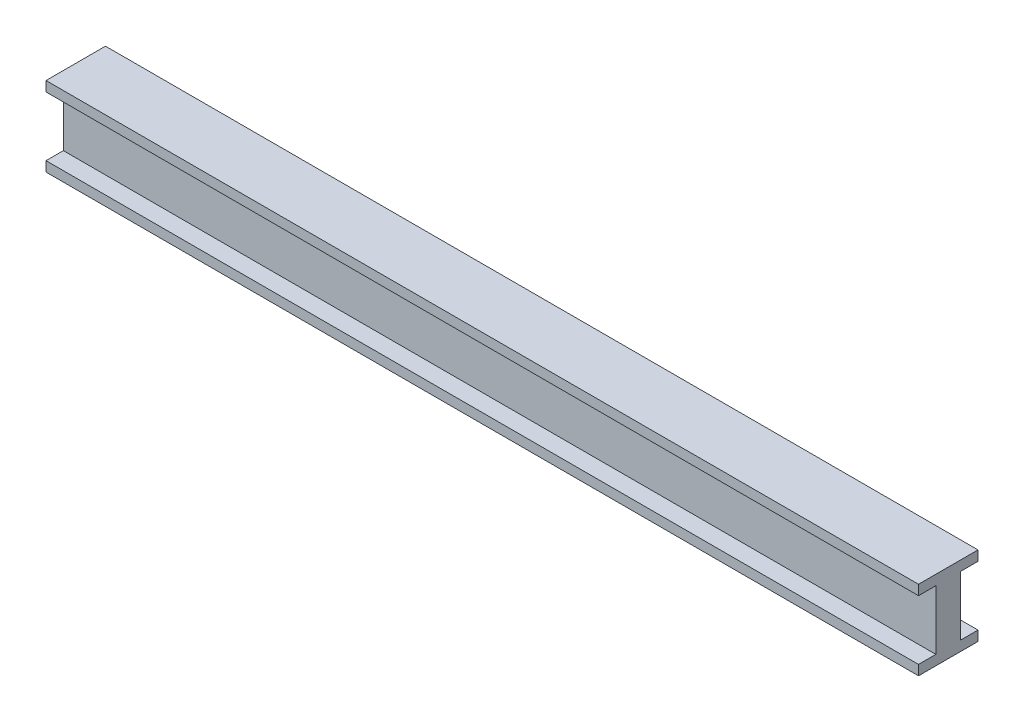
from build123d import *

# Parameters (mm, degrees)
SKETCH2_W           = 38.1
SKETCH2_H           = 6.35
SKETCH2_W_2         = 15.875
SKETCH2_H_2         = 38.1
BOSS_EXTRUDE1_DEPTH = 558.8


with BuildPart() as part:
    # Sketch2 → Boss-Extrude1 (new body)
    with BuildSketch(Plane(origin=(0, 0, 0), x_dir=(0, 0, -1), z_dir=(1, 0, 0))):
        with Locations((0, 22.225)):
            Rectangle(SKETCH2_W, SKETCH2_H)
        Rectangle(SKETCH2_W_2, SKETCH2_H_2)
        with Locations((0, -22.225)):
            Rectangle(SKETCH2_W, SKETCH2_H)
    extrude(amount=BOSS_EXTRUDE1_DEPTH)


solid = part.part
